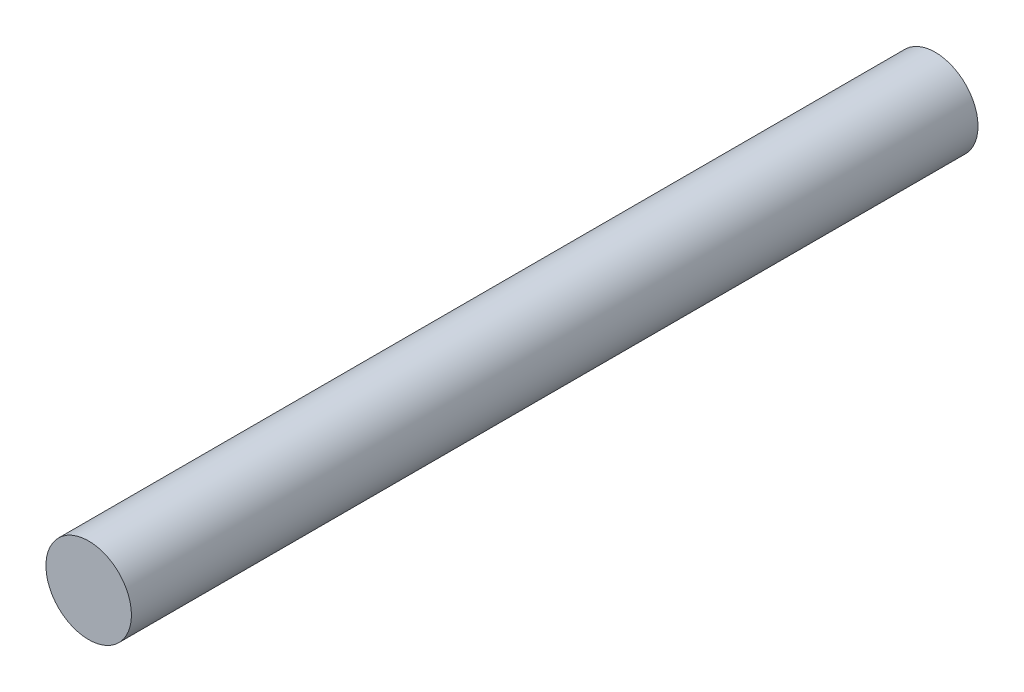
from build123d import *

# Parameters (mm, degrees)
SKETCH1_R           = 5
BOSS_EXTRUDE1_DEPTH = 99


with BuildPart() as part:
    # Sketch1 → Boss-Extrude1 (new body)
    with BuildSketch(Plane(origin=(0, 0, 0), x_dir=(0, 1, 0), z_dir=(0, 0, 1))):
        with Locations(Location((0, 0, 0), (0, 0, 270))):
            Circle(SKETCH1_R)
    extrude(amount=BOSS_EXTRUDE1_DEPTH)


solid = part.part
